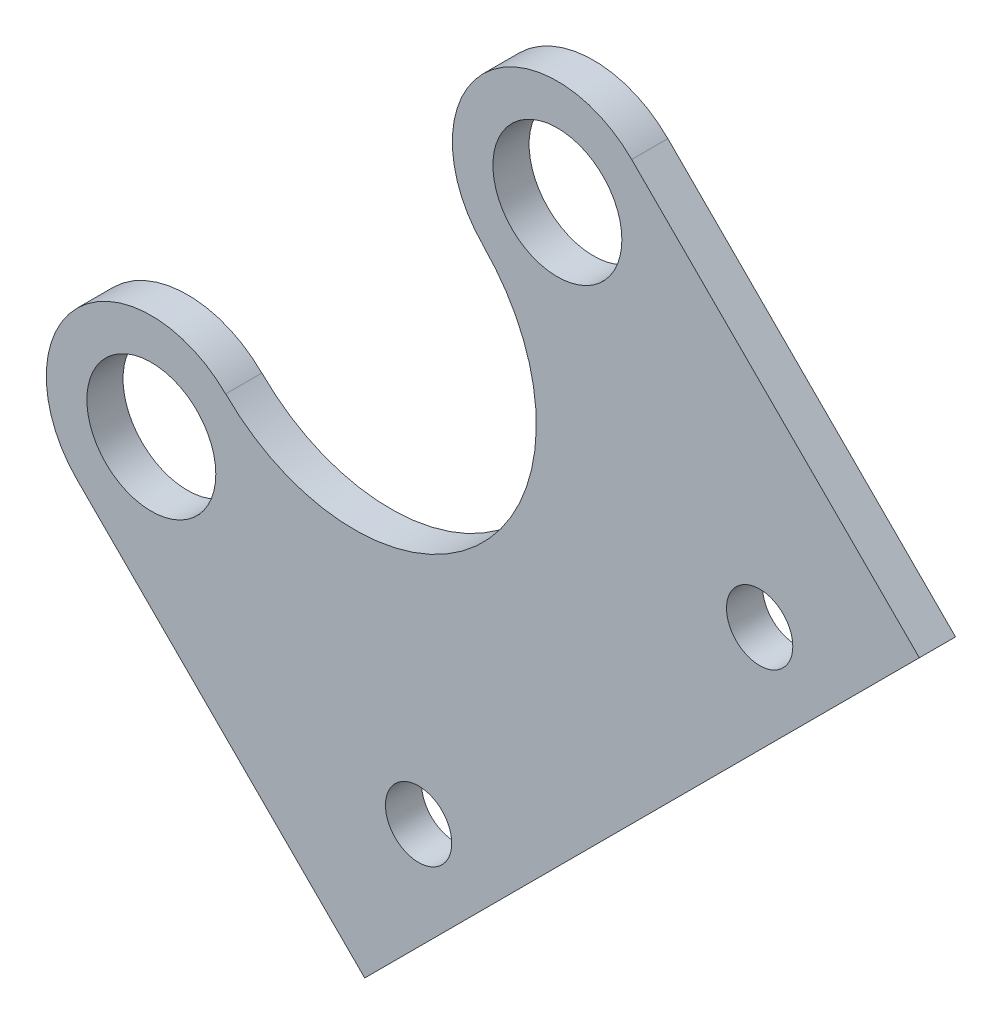
from build123d import *

# Parameters (mm, degrees)
SKETCH8_R           = 2.75
SKETCH8_R_2         = 5.3467
BOSS_EXTRUDE1_DEPTH = 3


with BuildPart() as part:
    # Sketch8 → Boss-Extrude1 (new body)
    with BuildSketch(Plane.XY):
        with BuildLine():
            Line((-22.998435926, -22.998435926), (0.859030886, -46.855902739))
            Line((0.859030886, -46.855902739), (46.855902739, -0.859030886))
            Line((46.855902739, -0.859030886), (22.998435926, 22.998435926))
            ThreePointArc((22.998435926, 22.998435926), (10.677524528, 22.998435926), (10.677524528, 10.677524528))
            Line((10.677524528, 10.677524528), (10.668544272, 10.668544272))
            ThreePointArc((10.668544272, 10.668544272), (10.668544272, -10.668544272), (-10.668544272, -10.668544272))
            Line((-10.668544272, -10.668544272), (-10.677524528, -10.677524528))
            ThreePointArc((-10.677524528, -10.677524528), (-22.998435926, -10.677524528), (-22.998435926, -22.998435926))
        make_face()
        with Locations((33.610182952, -5.29098063)):
            Circle(SKETCH8_R, mode=Mode.SUBTRACT)
        with Locations((16.837980227, 16.837980227)):
            Circle(SKETCH8_R_2, mode=Mode.SUBTRACT)
        with Locations((-16.837980227, -16.837980227)):
            Circle(SKETCH8_R_2, mode=Mode.SUBTRACT)
        with Locations((5.325911705, -33.575251877)):
            Circle(SKETCH8_R, mode=Mode.SUBTRACT)
    extrude(amount=BOSS_EXTRUDE1_DEPTH)


solid = part.part
